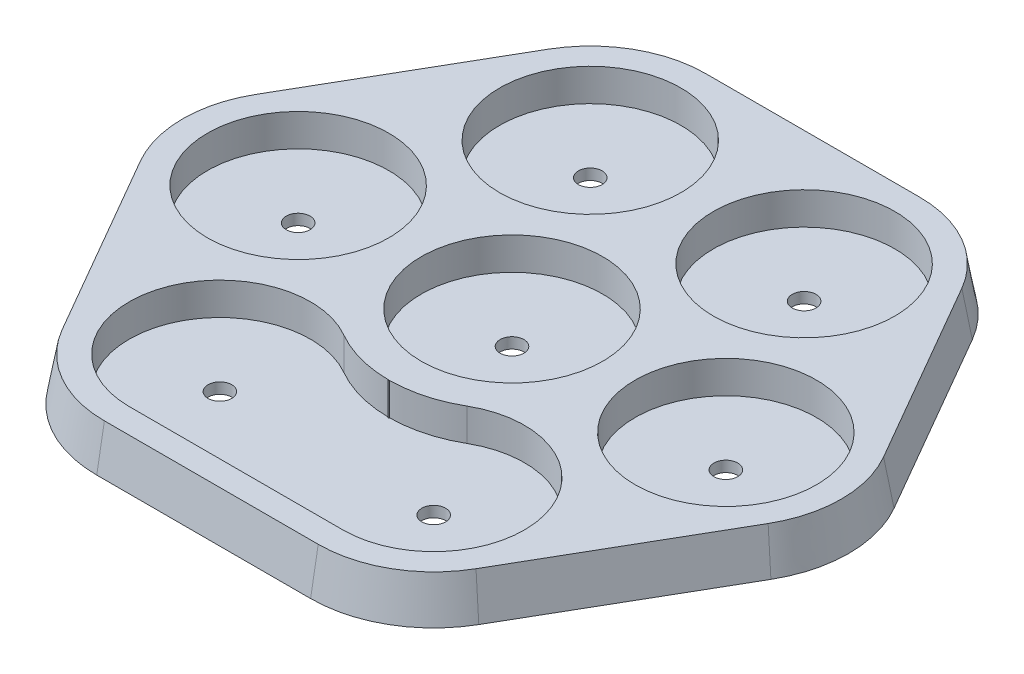
from build123d import *

# Parameters (mm, degrees)
BOSS_EXTRUDE1_DEPTH = 4
BOSS_EXTRUDE1_TAPER = 10
CUT_EXTRUDE1_START  = 4
SKETCH1_3_R         = 1.1
CUT_EXTRUDE1_DEPTH  = 4
CUT_EXTRUDE2_START  = 4
SKETCH1_4_R         = 8.4
SKETCH1_4_R_2       = 1.1
CUT_EXTRUDE2_DEPTH  = 3


with BuildPart() as part:
    # Sketch1 → Boss-Extrude1 (new body)
    with BuildSketch(Plane(origin=(0, 0, 0), x_dir=(1, 0, 0), z_dir=(0, 1, 0))):
        with BuildLine():
            ThreePointArc((-29.7, 28.547302995), (-35.4, 27.019992598), (-39.572689603, 22.847302995))
            Line((-39.572689603, 22.847302995), (-49.472689603, 5.7))
            ThreePointArc((-49.472689603, 5.7), (-51, 0), (-49.472689603, -5.7))
            Line((-49.472689603, -5.7), (-39.572689603, -22.847302995))
            ThreePointArc((-39.572689603, -22.847302995), (-35.4, -27.019992598), (-29.7, -28.547302995))
            Line((-29.7, -28.547302995), (-9.9, -28.547302995))
            ThreePointArc((-9.9, -28.547302995), (-4.2, -27.019992598), (-0.027310397, -22.847302995))
            Line((-0.027310397, -22.847302995), (9.872689603, -5.7))
            ThreePointArc((9.872689603, -5.7), (11.4, 0), (9.872689603, 5.7))
            Line((9.872689603, 5.7), (-0.027310397, 22.847302995))
            ThreePointArc((-0.027310397, 22.847302995), (-4.2, 27.019992598), (-9.9, 28.547302995))
            Line((-9.9, 28.547302995), (-29.7, 28.547302995))
        make_face()
    extrude(amount=BOSS_EXTRUDE1_DEPTH, taper=BOSS_EXTRUDE1_TAPER)

    # Sketch1<3> → Cut-Extrude1 (cut)
    with BuildSketch(Plane(origin=(0, 0, 0), x_dir=(1, 0, 0), z_dir=(0, 1, 0)).offset(CUT_EXTRUDE1_START)):
        with Locations(Location((-9.9, -17.147302995, 0), (0, 0, 270))):
            Circle(SKETCH1_3_R)
        with Locations(Location((0, 0, 0), (0, 0, 270))):
            Circle(SKETCH1_3_R)
        with Locations(Location((-29.7, -17.147302995, 0), (0, 0, 270))):
            Circle(SKETCH1_3_R)
        with Locations(Location((-39.6, 0, 0), (0, 0, 270))):
            Circle(SKETCH1_3_R)
        with Locations(Location((-9.9, 17.147302995, 0), (0, 0, 270))):
            Circle(SKETCH1_3_R)
        with Locations(Location((-29.7, 17.147302995, 0), (0, 0, 270))):
            Circle(SKETCH1_3_R)
        with Locations(Location((-19.8, 0, 0), (0, 0, 270))):
            Circle(SKETCH1_3_R)
    extrude(amount=-CUT_EXTRUDE1_DEPTH, mode=Mode.SUBTRACT)

    # Sketch1<4> → Cut-Extrude2 (cut)
    # profile 1 of 6: a face of its own
    with BuildSketch(Plane(origin=(0, 0, 0), x_dir=(1, 0, 0), z_dir=(0, 1, 0)).offset(CUT_EXTRUDE2_START)):
        with Locations(Location((0, 0, 0), (0, 0, 270))):
            Circle(SKETCH1_4_R)
        with Locations(Location((0, 0, 0), (0, 0, 270))):
            Circle(SKETCH1_4_R_2, mode=Mode.SUBTRACT)
    # profile 2 of 6: a face of its own
    with BuildSketch(Plane(origin=(0, 0, 0), x_dir=(1, 0, 0), z_dir=(0, 1, 0)).offset(CUT_EXTRUDE2_START)):
        with BuildLine():
            Line((-29.7, -25.547302995), (-9.9, -25.547302995))
            ThreePointArc((-9.9, -25.547302995), (-1.786223222, -14.97322241), (-14.100001087, -9.872690231))
            ThreePointArc((-14.100001087, -9.872690231), (-16.822981756, -11.004424673), (-19.745150662, -11.39986805))
            ThreePointArc((-19.745150662, -11.39986805), (-19.772689603, -11.447302995), (-19.8, -11.494869891))
            ThreePointArc((-19.8, -11.494869891), (-19.827310397, -11.447302995), (-19.854849338, -11.39986805))
            ThreePointArc((-19.854849338, -11.39986805), (-22.777018876, -11.004424502), (-25.500000049, -9.872689575))
            ThreePointArc((-25.500000049, -9.872689575), (-37.813776948, -14.973223043), (-29.7, -25.547302995))
        make_face()
        with Locations(Location((-9.9, -17.147302995, 0), (0, 0, 270))):
            Circle(SKETCH1_4_R_2, mode=Mode.SUBTRACT)
        with Locations(Location((-29.7, -17.147302995, 0), (0, 0, 270))):
            Circle(SKETCH1_4_R_2, mode=Mode.SUBTRACT)
    # profile 3 of 6: a face of its own
    with BuildSketch(Plane(origin=(0, 0, 0), x_dir=(1, 0, 0), z_dir=(0, 1, 0)).offset(CUT_EXTRUDE2_START)):
        with Locations(Location((-9.9, 17.147302995, 0), (0, 0, 270))):
            Circle(SKETCH1_4_R)
        with Locations(Location((-9.9, 17.147302995, 0), (0, 0, 270))):
            Circle(SKETCH1_4_R_2, mode=Mode.SUBTRACT)
    # profile 4 of 6: a face of its own
    with BuildSketch(Plane(origin=(0, 0, 0), x_dir=(1, 0, 0), z_dir=(0, 1, 0)).offset(CUT_EXTRUDE2_START)):
        with Locations(Location((-19.8, 0, 0), (0, 0, 270))):
            Circle(SKETCH1_4_R)
        with Locations(Location((-19.8, 0, 0), (0, 0, 270))):
            Circle(SKETCH1_4_R_2, mode=Mode.SUBTRACT)
    # profile 5 of 6: a face of its own
    with BuildSketch(Plane(origin=(0, 0, 0), x_dir=(1, 0, 0), z_dir=(0, 1, 0)).offset(CUT_EXTRUDE2_START)):
        with Locations(Location((-39.6, 0, 0), (0, 0, 270))):
            Circle(SKETCH1_4_R)
        with Locations(Location((-39.6, 0, 0), (0, 0, 270))):
            Circle(SKETCH1_4_R_2, mode=Mode.SUBTRACT)
    # profile 6 of 6: a face of its own
    with BuildSketch(Plane(origin=(0, 0, 0), x_dir=(1, 0, 0), z_dir=(0, 1, 0)).offset(CUT_EXTRUDE2_START)):
        with Locations(Location((-29.7, 17.147302995, 0), (0, 0, 270))):
            Circle(SKETCH1_4_R)
        with Locations(Location((-29.7, 17.147302995, 0), (0, 0, 270))):
            Circle(SKETCH1_4_R_2, mode=Mode.SUBTRACT)
    extrude(amount=-CUT_EXTRUDE2_DEPTH, mode=Mode.SUBTRACT)


solid = part.part
